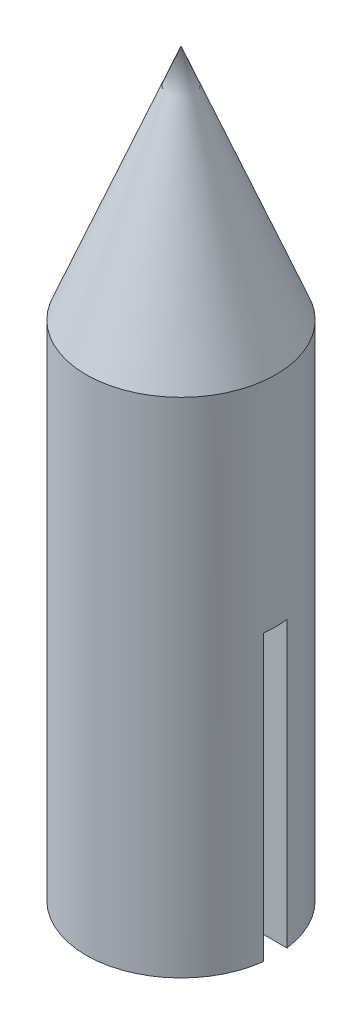
from build123d import *

# Parameters (mm, degrees)
SKETCH1_R               = 2.54
SKETCH1_R_2             = 1.27
BOSS_EXTRUDE1_DEPTH     = 11.43
BOSS_EXTRUDE2_START     = 11.43
SKETCH1_2_R             = 2.54
SKETCH1_2_R_2           = 1.27
BOSS_EXTRUDE2_DEPTH     = 2.032
CUT_EXTRUDE1_DEPTH      = 21.135007922
CUT_EXTRUDE1_DEPTH_BACK = 21.135007922
SKETCH4_W               = 0.635
SKETCH4_H               = 7.62


with BuildPart() as part:
    # Sketch1 → Boss-Extrude1 (new body)
    with BuildSketch(Plane(origin=(0, 0, 0), x_dir=(1, 0, 0), z_dir=(0, 1, 0))):
        with Locations(Location((0, 0, 0), (0, 0, 270))):
            Circle(SKETCH1_R)
        with Locations(Location((0, 0, 0), (0, 0, 270))):
            Circle(SKETCH1_R_2, mode=Mode.SUBTRACT)
    extrude(amount=BOSS_EXTRUDE1_DEPTH)

    # Sketch1<2> → Boss-Extrude2 (add)
    # profile 1 of 2: a face of its own
    with BuildSketch(Plane(origin=(0, 0, 0), x_dir=(1, 0, 0), z_dir=(0, 1, 0)).offset(BOSS_EXTRUDE2_START)):
        with Locations(Location((0, 0, 0), (0, 0, 270))):
            Circle(SKETCH1_2_R)
        with Locations(Location((0, 0, 0), (0, 0, 270))):
            Circle(SKETCH1_2_R_2, mode=Mode.SUBTRACT)
    # profile 2 of 2: a face of its own
    with BuildSketch(Plane(origin=(0, 0, 0), x_dir=(1, 0, 0), z_dir=(0, 1, 0)).offset(BOSS_EXTRUDE2_START)):
        with Locations(Location((0, 0, 0), (0, 0, 270))):
            Circle(SKETCH1_2_R_2)
    extrude(amount=BOSS_EXTRUDE2_DEPTH)

    # Sketch3 → Revolve1 (revolve)
    with BuildSketch(Plane(origin=(0, 0, 0), x_dir=(0, 0, -1), z_dir=(1, 0, 0))):
        Polygon((0, 13.462), (0, 19.812), (2.54, 13.462), align=None)
    revolve(axis=Axis((0, 13.462, 0), (0, -1, 0)))

    # Sketch4 → Cut-Extrude1 (cut, two sides: drawn at the far end of the back side and taken through both)
    with BuildSketch(Plane(origin=(0, 0, 0), x_dir=(0, 0, -1), z_dir=(1, 0, 0)).offset(-CUT_EXTRUDE1_DEPTH_BACK)):
        with Locations((0, 3.81)):
            Rectangle(SKETCH4_W, SKETCH4_H)
    extrude(amount=CUT_EXTRUDE1_DEPTH + CUT_EXTRUDE1_DEPTH_BACK, mode=Mode.SUBTRACT)


solid = part.part
